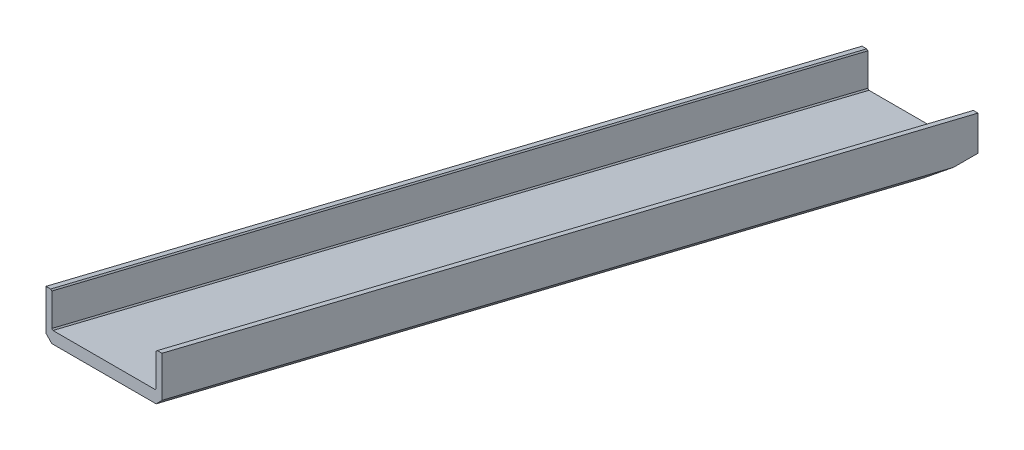
from build123d import *

# Parameters (mm, degrees)
EXTRUDE_1_DEPTH = 450
EXTRUDE_2_DEPTH = 50
CHAMFER_1_SIZE  = 10
CHAMFER_3_SIZE  = 50
CHAMFER_2_SIZE  = 10


with BuildPart() as part:
    # ｽｹｯﾁ1 → ﾎﾞｽ - 押し出し1 (new body)
    with BuildSketch(Plane(origin=(0, 0, 0), x_dir=(0, 0, -1), z_dir=(1, 0, 0))):
        Polygon((-9737.78080468, -2275), (-9737.78080468, -2377.960030638), (-3120.063841898, -4000), (-2700, -4000), align=None)
    extrude(amount=EXTRUDE_1_DEPTH)

    # ｽｹｯﾁ2 → ﾎﾞｽ - 押し出し2 (add)
    with BuildSketch(Plane(origin=(450, 0, 0), x_dir=(0, 0, -1), z_dir=(1, 0, 0))):
        Polygon((-2700, -4000), (-2700, -3700), (-9737.78080468, -1975), (-9737.78080468, -2377.960030638), (-3120.063841898, -4000), align=None)
    extrude(amount=EXTRUDE_2_DEPTH)

    # 面取り1
    chamfer_1_edges = [part.edges().sort_by_distance(p)[0] for p in [
        (450, -3137.5, 6218.89040234),
    ]]
    chamfer(chamfer_1_edges, length=CHAMFER_1_SIZE)

    # 面取り3
    chamfer_3_edges = [part.edges().sort_by_distance(p)[0] for p in [
        (500, -3188.980015319, 6428.922323289),
    ]]
    chamfer(chamfer_3_edges, length=CHAMFER_3_SIZE)

    # 面取り2
    chamfer_2_edges = [part.edges().sort_by_distance(p)[0] for p in [
        (450, -2837.5, 6218.89040234),
    ]]
    chamfer(chamfer_2_edges, length=CHAMFER_2_SIZE)

    # ﾐﾗｰ1: part across plane


with BuildPart() as part_1:
    add(part.part)
    add(part.part.mirror(Plane(origin=(0, 0, 0), x_dir=(0, 0, 1), z_dir=(1, 0, 0))))


solid = part_1.part
